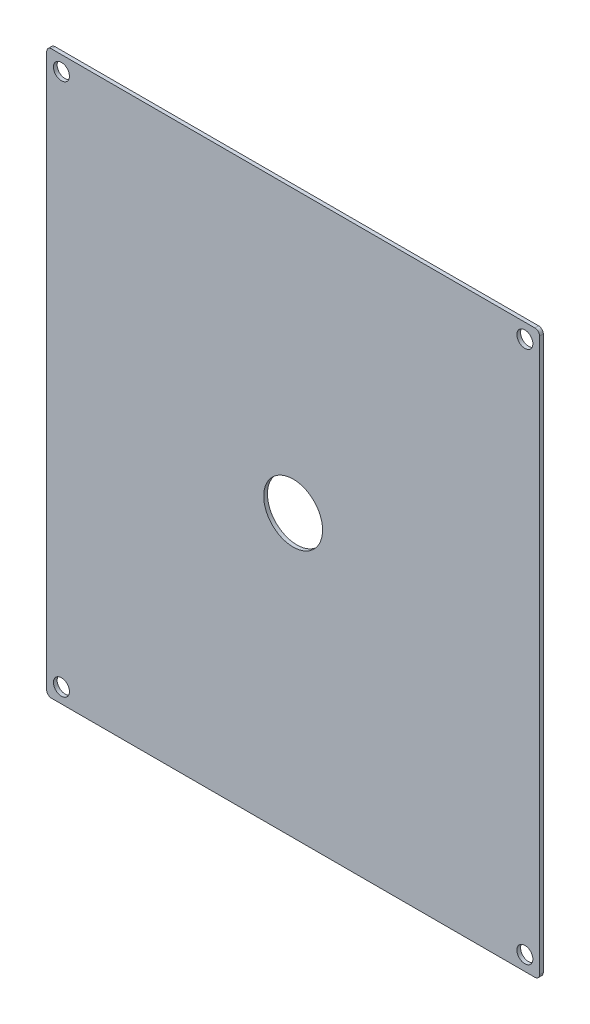
from build123d import *

# Parameters (mm, degrees)
SKETCH1_W           = 106.35
SKETCH1_H           = 121.35
SKETCH1_R           = 1.725
SKETCH1_R_2         = 6.35
BOSS_EXTRUDE1_DEPTH = 0.8
FILLET1_R           = 1


with BuildPart() as part:
    # Sketch1 → Boss-Extrude1 (new body)
    with BuildSketch(Plane.XY):
        with Locations((50, -57.5)):
            Rectangle(SKETCH1_W, SKETCH1_H)
        Circle(SKETCH1_R, mode=Mode.SUBTRACT)
        with Locations((100, 0)):
            Circle(SKETCH1_R, mode=Mode.SUBTRACT)
        with Locations((100, -115)):
            Circle(SKETCH1_R, mode=Mode.SUBTRACT)
        with Locations((0, -115)):
            Circle(SKETCH1_R, mode=Mode.SUBTRACT)
        with Locations((50, -57.5)):
            Circle(SKETCH1_R_2, mode=Mode.SUBTRACT)
    extrude(amount=BOSS_EXTRUDE1_DEPTH)

    # Fillet1
    fillet1_edges = [part.edges().sort_by_distance(p)[0] for p in [
        (-3.175, 3.175, 0.4),
        (103.175, 3.175, 0.4),
        (103.175, -118.175, 0.4),
        (-3.175, -118.175, 0.4),
    ]]
    fillet(fillet1_edges, radius=FILLET1_R)


solid = part.part
